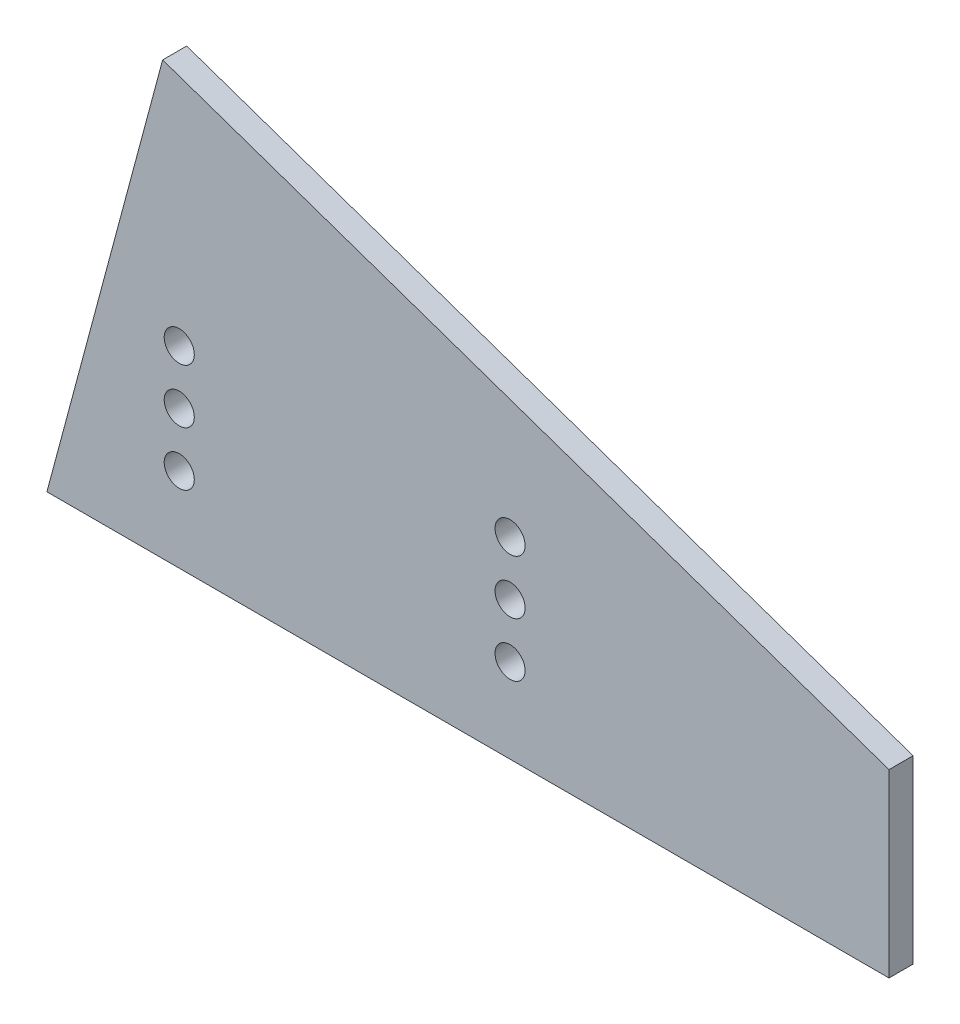
from build123d import *

# Parameters (mm, degrees)
BOSS_EXTRUDE1_DEPTH = 4
SKETCH2_R           = 2.5
CUT_EXTRUDE1_DEPTH  = 10


with BuildPart() as part:
    # Sketch1 → Boss-Extrude1 (new body)
    with BuildSketch(Plane.XY):
        Polygon((75.421686747, -40), (75.421686747, -10), (-45.337786669, 31.806622775), (-64.578313253, -40), align=None)
    extrude(amount=BOSS_EXTRUDE1_DEPTH)

    # Sketch2 → Cut-Extrude1 (cut)
    with BuildSketch(Plane.XY.offset(4)):
        with Locations((-42.578313253, -17)):
            Circle(SKETCH2_R)
        with Locations((-42.578313253, -8)):
            Circle(SKETCH2_R)
        with Locations((-42.578313253, -26)):
            Circle(SKETCH2_R)
        with Locations((12.421686747, -17)):
            Circle(SKETCH2_R)
        with Locations((12.421686747, -8)):
            Circle(SKETCH2_R)
        with Locations((12.421686747, -26)):
            Circle(SKETCH2_R)
    extrude(amount=-CUT_EXTRUDE1_DEPTH, mode=Mode.SUBTRACT)


solid = part.part
